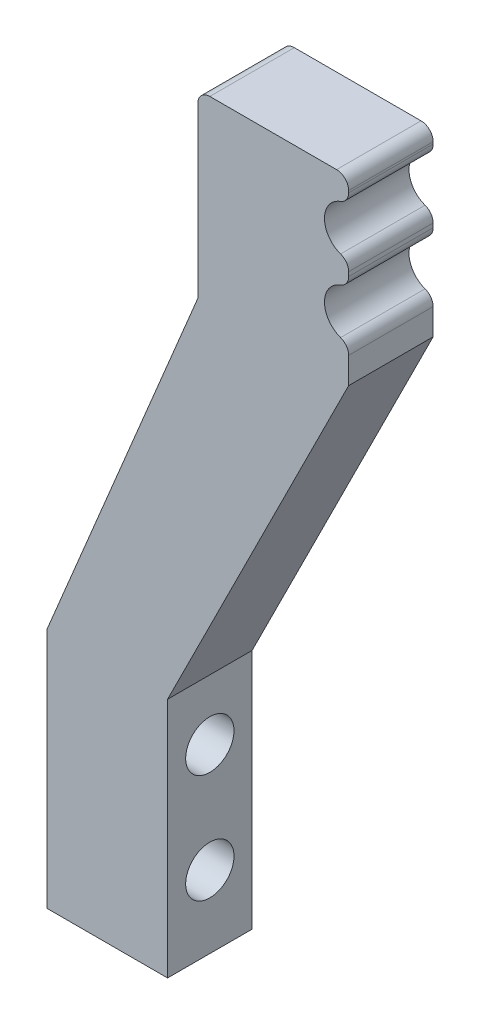
from build123d import *

# Parameters (mm, degrees)
BOSS_EXTRUDE2_DEPTH = 70
SKETCH2_W           = 100
SKETCH2_H           = 200
BOSS_EXTRUDE3_DEPTH = 70
SKETCH3_R           = 20
CUT_EXTRUDE1_DEPTH  = 132
CUT_EXTRUDE2_DEPTH  = 132
CUT_EXTRUDE3_DEPTH  = 132
CUT_EXTRUDE4_DEPTH  = 79
CUT_EXTRUDE6_DEPTH  = 79
CUT_EXTRUDE7_DEPTH  = 79
CUT_EXTRUDE8_DEPTH  = 79


with BuildPart() as part:
    # Sketch1 → Boss-Extrude2 (new body)
    with BuildSketch(Plane.XY):
        Polygon((-137.278106509, 244.304733728), (-12.278106509, 244.304733728), (-12.278106509, -205.695266272), (-262.278106509, -205.695266272), (-137.278106509, 94.304733728), align=None)
    extrude(amount=BOSS_EXTRUDE2_DEPTH)

    # Sketch2 → Boss-Extrude3 (add)
    with BuildSketch(Plane.XY.offset(70)):
        with Locations((-212.278106509, -305.695266272)):
            Rectangle(SKETCH2_W, SKETCH2_H)
    extrude(amount=-BOSS_EXTRUDE3_DEPTH)

    # Sketch3 → Cut-Extrude1 (cut)
    with BuildSketch(Plane(origin=(-162.278106509, 0, 0), x_dir=(0, 0, -1), z_dir=(1, 0, 0))):
        with Locations((-35, -255.695266272)):
            Circle(SKETCH3_R)
        with Locations((-35, -345.695266272)):
            Circle(SKETCH3_R)
    extrude(amount=-CUT_EXTRUDE1_DEPTH, mode=Mode.SUBTRACT)

    # Sketch5 → Cut-Extrude2 (cut)
    with BuildSketch(Plane.XY.offset(70)):
        Polygon((-12.278106509, 94.304733728), (-12.278106509, -205.695266272), (-162.278106509, -205.695266272), align=None)
    extrude(amount=-CUT_EXTRUDE2_DEPTH, mode=Mode.SUBTRACT)

    # Sketch6 → Cut-Extrude3 (cut)
    with BuildSketch(Plane.XY.offset(70)):
        with BuildLine():
            Line((-12.278106509, 224.304733728), (-12.278106509, 204.304733728))
            Line((-12.278106509, 204.304733728), (-12.278106509, 184.304733728))
            ThreePointArc((-12.278106509, 184.304733728), (-32.278106509, 204.304733728), (-12.278106509, 224.304733728))
        make_face()
        with BuildLine():
            Line((-12.278106509, 144.304733728), (-12.278106509, 124.304733728))
            ThreePointArc((-12.278106509, 124.304733728), (-32.278106509, 144.304733728), (-12.278106509, 164.304733728))
            Line((-12.278106509, 164.304733728), (-12.278106509, 144.304733728))
        make_face()
    extrude(amount=-CUT_EXTRUDE3_DEPTH, mode=Mode.SUBTRACT)

    # Sketch9 → Cut-Extrude4 (cut)
    with BuildSketch(Plane.XY.offset(70)):
        with BuildLine():
            Line((-127.278106509, 244.304733728), (-137.278106509, 244.304733728))
            Line((-137.278106509, 244.304733728), (-137.278106509, 234.304733728))
            ThreePointArc((-137.278106509, 234.304733728), (-134.349174321, 241.37580154), (-127.278106509, 244.304733728))
        make_face()
    extrude(amount=-CUT_EXTRUDE4_DEPTH, mode=Mode.SUBTRACT)

    # Sketch11 → Cut-Extrude6 (cut)
    with BuildSketch(Plane.XY.offset(70)):
        with BuildLine():
            Line((-12.278106509, 232.589004975), (-12.278106509, 224.304733728))
            Line((-12.278106509, 224.304733728), (-18.944773176, 223.160914559))
            ThreePointArc((-18.944773176, 223.160914559), (-14.1131407, 226.815502283), (-12.278106509, 232.589004975))
        make_face()
    extrude(amount=-CUT_EXTRUDE6_DEPTH, mode=Mode.SUBTRACT)

    # Sketch12 → Cut-Extrude7 (cut)
    with BuildSketch(Plane.XY.offset(70)):
        with BuildLine():
            Line((-18.944773176, 125.448552896), (-12.278106509, 124.304733728))
            Line((-12.278106509, 124.304733728), (-12.278106509, 116.02046248))
            ThreePointArc((-12.278106509, 116.02046248), (-14.1131407, 121.793965172), (-18.944773176, 125.448552896))
        make_face()
        with BuildLine():
            Line((-18.944773176, 185.448552896), (-12.278106509, 184.304733728))
            Line((-12.278106509, 184.304733728), (-12.278106509, 176.02046248))
            ThreePointArc((-12.278106509, 176.02046248), (-14.1131407, 181.793965172), (-18.944773176, 185.448552896))
        make_face()
        with BuildLine():
            Line((-18.944773176, 163.160914559), (-12.278106509, 164.304733728))
            Line((-12.278106509, 164.304733728), (-12.278106509, 172.589004975))
            ThreePointArc((-12.278106509, 172.589004975), (-14.1131407, 166.815502283), (-18.944773176, 163.160914559))
        make_face()
    extrude(amount=-CUT_EXTRUDE7_DEPTH, mode=Mode.SUBTRACT)

    # Sketch13 → Cut-Extrude8 (cut)
    with BuildSketch(Plane.XY.offset(70)):
        with BuildLine():
            Line((-22.278106509, 244.304733728), (-12.278106509, 244.304733728))
            Line((-12.278106509, 244.304733728), (-12.278106509, 234.304733728))
            ThreePointArc((-12.278106509, 234.304733728), (-15.207038697, 241.37580154), (-22.278106509, 244.304733728))
        make_face()
    extrude(amount=-CUT_EXTRUDE8_DEPTH, mode=Mode.SUBTRACT)


solid = part.part
